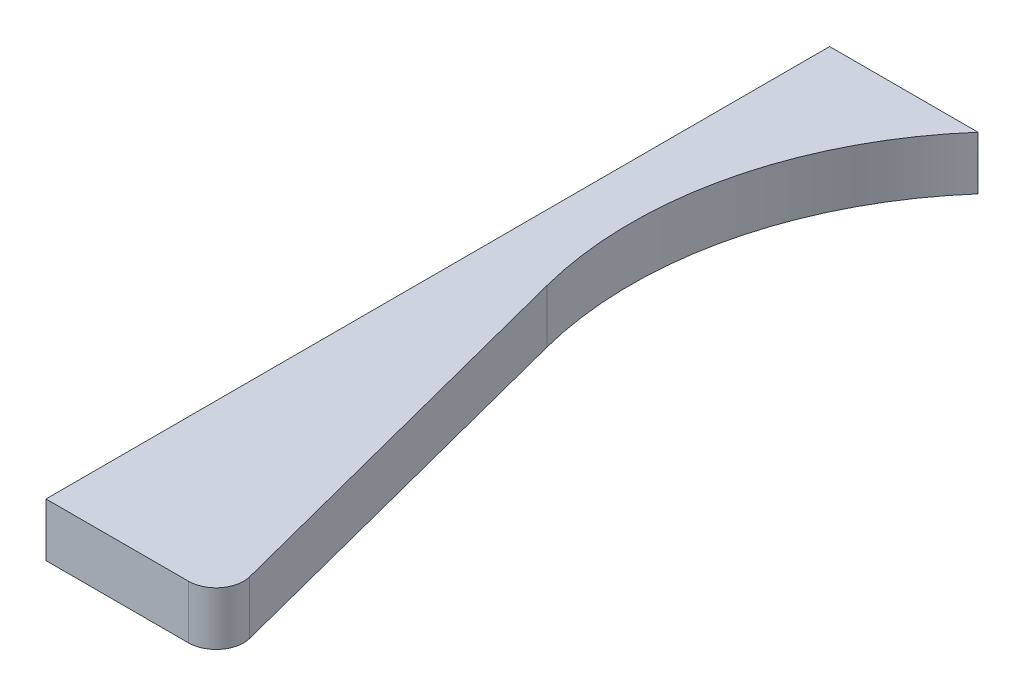
from build123d import *

# Parameters (mm, degrees)
BOSS_EXTRUDE1_DEPTH = 19.05


with BuildPart() as part:
    # Sketch1 → Boss-Extrude1 (new body)
    with BuildSketch(Plane(origin=(0, 0, 0), x_dir=(1, 0, 0), z_dir=(0, 1, 0))):
        with BuildLine():
            Line((50.8, -279.4), (0, -279.4))
            Line((0, -279.4), (0, 0))
            Line((0, 0), (52.907108287, 0))
            ThreePointArc((52.907108287, 0), (22.753262856, -58.398850563), (23.389451167, -124.120045058))
            Line((23.389451167, -124.120045058), (60.329571515, -267.095372264))
            ThreePointArc((60.329571515, -267.095372264), (58.58165466, -275.584162178), (50.8, -279.4))
        make_face()
    extrude(amount=BOSS_EXTRUDE1_DEPTH)


solid = part.part
